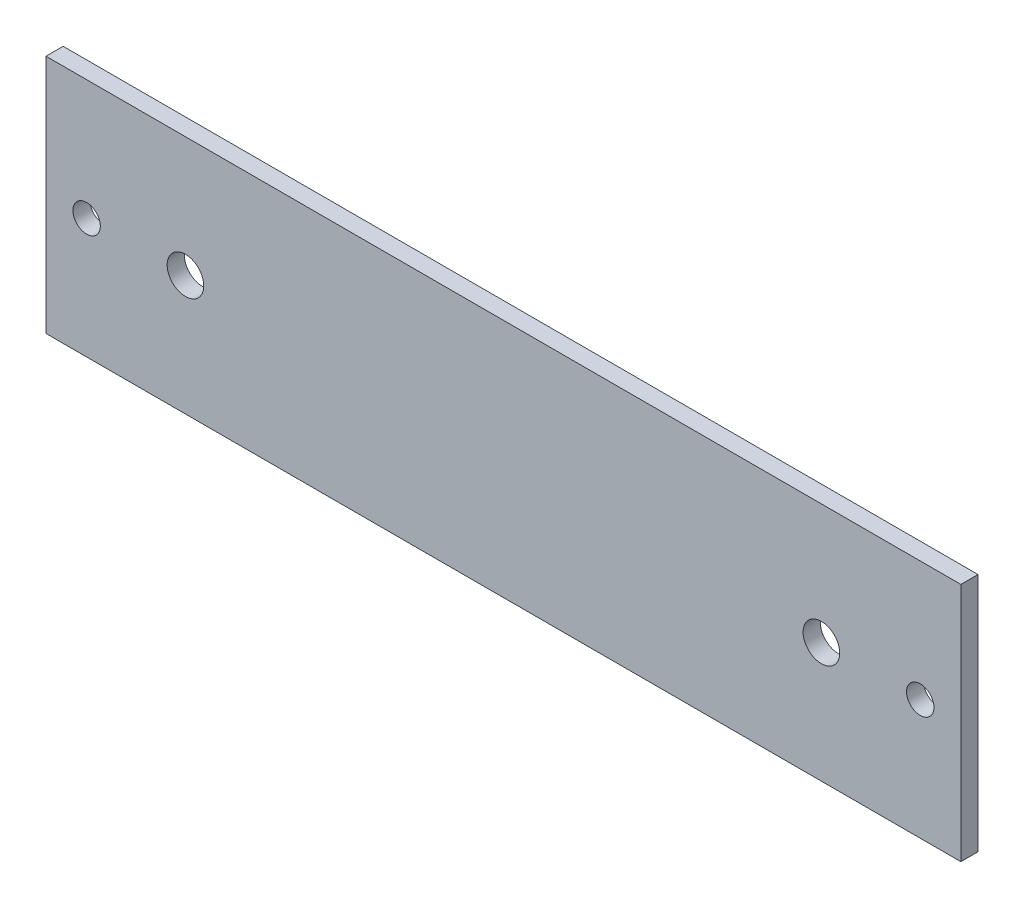
from build123d import *

# Parameters (mm, degrees)
SKETCH1_W           = 80
SKETCH1_H           = 21
SKETCH1_R           = 1.2
SKETCH1_R_2         = 1.6
BOSS_EXTRUDE1_DEPTH = 1.5


with BuildPart() as part:
    # Sketch1 → Boss-Extrude1 (new body)
    with BuildSketch(Plane.XY):
        Rectangle(SKETCH1_W, SKETCH1_H)
        with Locations((-36.45, 0)):
            Circle(SKETCH1_R, mode=Mode.SUBTRACT)
        with Locations((-27.805, 0)):
            Circle(SKETCH1_R_2, mode=Mode.SUBTRACT)
        with Locations(Location((27.805, 0, 0), (0, 0, 180))):
            Circle(SKETCH1_R_2, mode=Mode.SUBTRACT)
        with Locations(Location((36.45, 0, 0), (0, 0, 180))):
            Circle(SKETCH1_R, mode=Mode.SUBTRACT)
    extrude(amount=BOSS_EXTRUDE1_DEPTH)


solid = part.part
